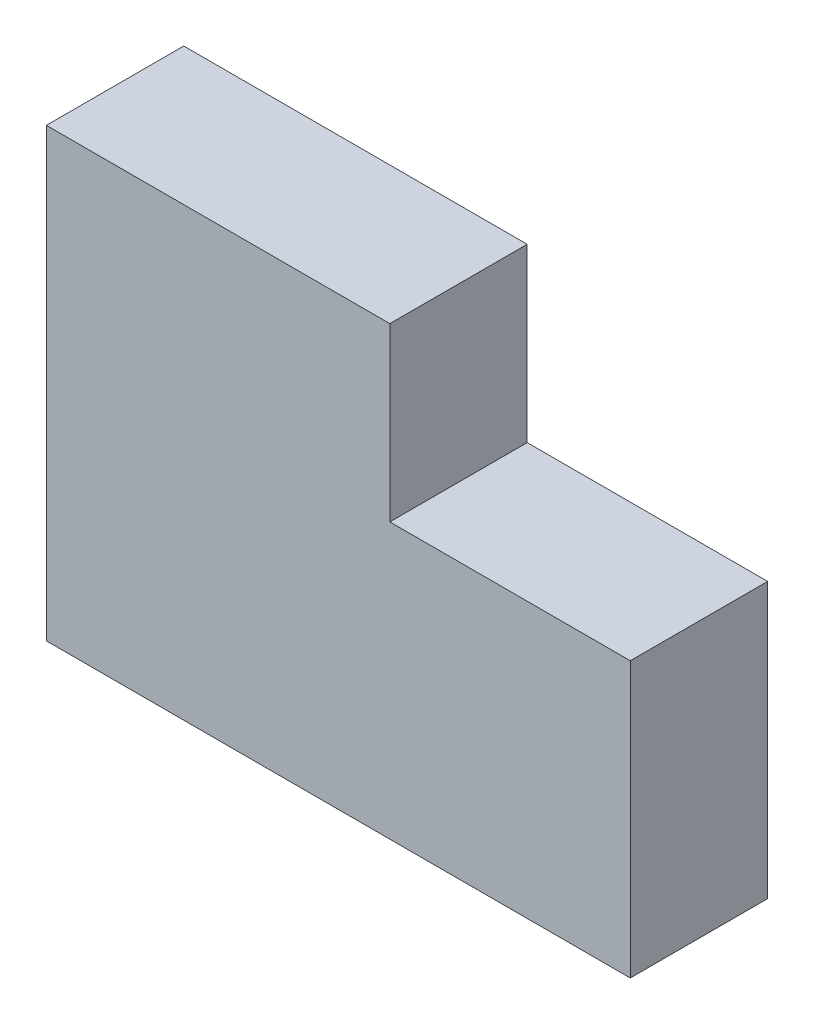
from build123d import *

# Parameters (mm, degrees)
RESSALTO_EXTRUS_O2_DEPTH = 20


with BuildPart() as part:
    # Esboço1 → Ressalto-extrusão2 (new body)
    with BuildSketch(Plane.XY):
        Polygon((0, 0), (0, 65), (50, 65), (50, 40), (85, 40), (85, 0), align=None)
    extrude(amount=-RESSALTO_EXTRUS_O2_DEPTH)


solid = part.part
